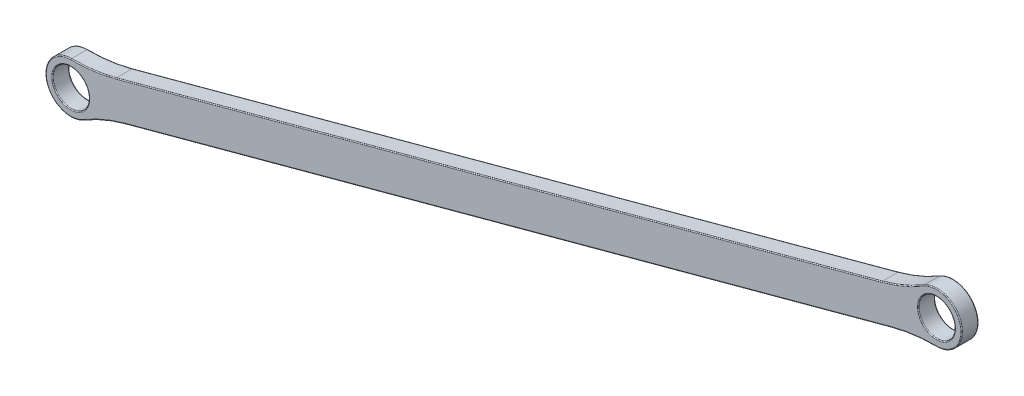
from build123d import *

# Parameters (mm, degrees)
BOSS_EXTRUDE1_DEPTH = 3
FILLET1_R           = 30
FILLET2_R           = 0.15


with BuildPart() as part:
    # Sketch2 → Boss-Extrude1 (new body)
    with BuildSketch(Plane.XY):
        with BuildLine():
            Line((-62.984695574, 232.099316618), (-59.979920905, 232.910999553))
            ThreePointArc((-59.979920905, 232.910999553), (-55.994832634, 230.621005781), (-58.284826407, 226.63591751))
            Line((-58.284826407, 226.63591751), (-61.289601076, 225.824234576))
            ThreePointArc((-61.289601076, 225.824234576), (-56.836455908, 225.90321801), (-54.632373656, 229.773458532))
            ThreePointArc((-54.632373656, 229.773458532), (-57.925196915, 234.108516123), (-62.984695574, 232.099316618))
        make_face()
        with BuildLine():
            Line((-63.476661224, 228.599931572), (-62.269914677, 228.925911283))
            ThreePointArc((-62.269914677, 228.925911283), (-61.950256595, 231.392728657), (-59.979920905, 232.910999553))
            Line((-59.979920905, 232.910999553), (-62.984695574, 232.099316618))
            ThreePointArc((-62.984695574, 232.099316618), (-63.588552029, 230.39993623), (-63.476661224, 228.599931572))
        make_face()
        with BuildLine():
            ThreePointArc((-58.284826407, 226.63591751), (-60.751643781, 226.955575592), (-62.269914677, 228.925911283))
            Line((-62.269914677, 228.925911283), (-63.476661224, 228.599931572))
            ThreePointArc((-63.476661224, 228.599931572), (-62.666994956, 226.988417731), (-61.289601076, 225.824234576))
            Line((-61.289601076, 225.824234576), (-58.284826407, 226.63591751))
        make_face()
        with BuildLine():
            Line((-209.251644063, 189.221582466), (-63.476661224, 228.599931572))
            ThreePointArc((-63.476661224, 228.599931572), (-63.588552029, 230.39993623), (-62.984695574, 232.099316618))
            Line((-62.984695574, 232.099316618), (-211.43870421, 191.997279462))
            ThreePointArc((-211.43870421, 191.997279462), (-210.06131033, 190.833096306), (-209.251644063, 189.221582466))
        make_face()
        with BuildLine():
            ThreePointArc((-61.289601076, 225.824234576), (-62.666994956, 226.988417731), (-63.476661224, 228.599931572))
            Line((-63.476661224, 228.599931572), (-209.251644063, 189.221582466))
            ThreePointArc((-209.251644063, 189.221582466), (-209.135029589, 188.639961725), (-209.095931631, 188.048055506))
            ThreePointArc((-209.095931631, 188.048055506), (-209.26087404, 186.840878765), (-209.743609712, 185.722197419))
            Line((-209.743609712, 185.722197419), (-61.289601076, 225.824234576))
        make_face()
        with BuildLine():
            Line((-214.44347888, 191.185596527), (-211.43870421, 191.997279462))
            ThreePointArc((-211.43870421, 191.997279462), (-217.940219199, 186.874528546), (-209.743609712, 185.722197419))
            Line((-209.743609712, 185.722197419), (-212.748384382, 184.910514484))
            ThreePointArc((-212.748384382, 184.910514484), (-216.733472652, 187.200508257), (-214.44347888, 191.185596527))
        make_face()
        with BuildLine():
            Line((-210.458390609, 188.895602755), (-209.251644063, 189.221582466))
            ThreePointArc((-209.251644063, 189.221582466), (-210.06131033, 190.833096306), (-211.43870421, 191.997279462))
            Line((-211.43870421, 191.997279462), (-214.44347888, 191.185596527))
            ThreePointArc((-214.44347888, 191.185596527), (-211.976661505, 190.865938445), (-210.458390609, 188.895602755))
        make_face()
        with BuildLine():
            ThreePointArc((-209.095931631, 188.048055506), (-209.135029589, 188.639961725), (-209.251644063, 189.221582466))
            Line((-209.251644063, 189.221582466), (-210.458390609, 188.895602755))
            ThreePointArc((-210.458390609, 188.895602755), (-210.778048691, 186.42878538), (-212.748384382, 184.910514484))
            Line((-212.748384382, 184.910514484), (-209.743609712, 185.722197419))
            ThreePointArc((-209.743609712, 185.722197419), (-209.26087404, 186.840878765), (-209.095931631, 188.048055506))
        make_face()
    extrude(amount=-BOSS_EXTRUDE1_DEPTH)

    # Fillet1
    fillet1_edges = [part.edges().sort_by_distance(p)[0] for p in [
        (-211.43870421, 191.997279462, -1.5),
        (-62.984695574, 232.099316618, -1.5),
        (-61.289601076, 225.824234576, -1.5),
        (-209.743609712, 185.722197419, -1.5),
    ]]
    fillet(fillet1_edges, radius=FILLET1_R)

    # Fillet2
    fillet2_edges = [part.edges().sort_by_distance(p)[0] for p in [
        (-216.733472652, 187.200508257, 0),
        (-54.788086088, 230.946985492, 0),
        (-54.788086088, 230.946985492, -3),
        (-137.211699892, 212.04829804, 0),
        (-137.211699892, 212.04829804, -3),
        (-135.516605394, 205.773215997, 0),
        (-135.516605394, 205.773215997, -3),
        (-217.940219199, 186.874528546, 0),
        (-217.940219199, 186.874528546, -3),
        (-65.037113368, 231.827660424, 0),
        (-55.994832634, 230.621005781, -3),
        (-65.037113368, 231.827660424, -3),
        (-63.199640786, 225.025507965, 0),
        (-63.199640786, 225.025507965, -3),
        (-207.691191918, 185.993853613, 0),
        (-207.691191918, 185.993853613, -3),
        (-209.528664501, 192.796006072, 0),
        (-209.528664501, 192.796006072, -3),
        (-216.733472652, 187.200508257, -3),
        (-55.994832634, 230.621005781, 0),
    ]]
    fillet(fillet2_edges, radius=FILLET2_R)


solid = part.part
